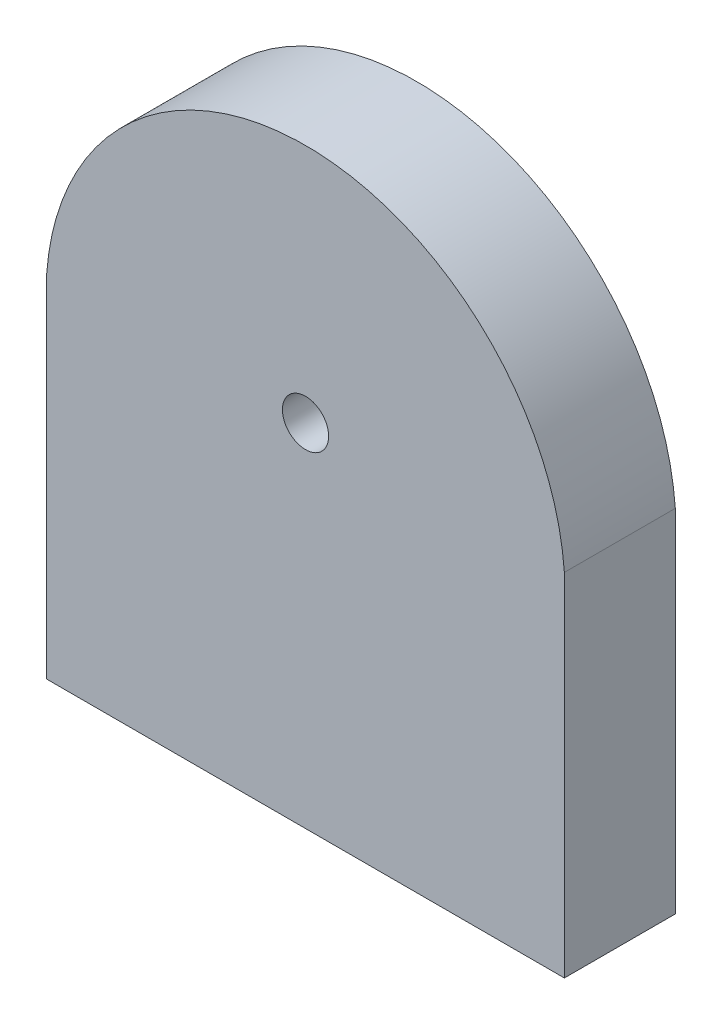
from build123d import *

# Parameters (mm, degrees)
ESQUISSE1_W             = 28
ESQUISSE1_H             = 32
BOSS_EXTRU_1_DEPTH      = 6
ESQUISSE2_R             = 1.25
ENL_V_MAT_EXTRU_1_DEPTH = 10
ESQUISSE3_R             = 1.25
ENL_V_MAT_EXTRU_2_DEPTH = 43.941821107
ENL_V_MAT_EXTRU_3_DEPTH = 43.941821107


with BuildPart() as part:
    # Esquisse1 → Boss.-Extru.1 (new body)
    with BuildSketch(Plane.XY):
        with Locations((14, 16)):
            Rectangle(ESQUISSE1_W, ESQUISSE1_H)
    extrude(amount=BOSS_EXTRU_1_DEPTH)

    # Esquisse2 → Enlèv. mat.-Extru.1 (cut)
    with BuildSketch(Plane.XZ):
        with Locations(Location((6, 3, 0), (0, 0, 270))):
            Circle(ESQUISSE2_R)
        with Locations(Location((22, 3, 0), (0, 0, 90))):
            Circle(ESQUISSE2_R)
    extrude(amount=-ENL_V_MAT_EXTRU_1_DEPTH, mode=Mode.SUBTRACT)

    # Esquisse3 → Enlèv. mat.-Extru.2 (cut, through all)
    with BuildSketch(Plane.XY.offset(6)):
        with Locations((14, 19)):
            Circle(ESQUISSE3_R)
    extrude(amount=-ENL_V_MAT_EXTRU_2_DEPTH, mode=Mode.SUBTRACT)

    # Esquisse5 → Enlèv. mat.-Extru.3 (cut, through all)
    with BuildSketch(Plane.XY.offset(6)):
        with BuildLine():
            Line((0, 19), (0, 33))
            Line((0, 33), (28, 33))
            Line((28, 33), (28, 19))
            ThreePointArc((28, 19), (14, 32), (0, 19))
        make_face()
    extrude(amount=-ENL_V_MAT_EXTRU_3_DEPTH, mode=Mode.SUBTRACT)


solid = part.part
